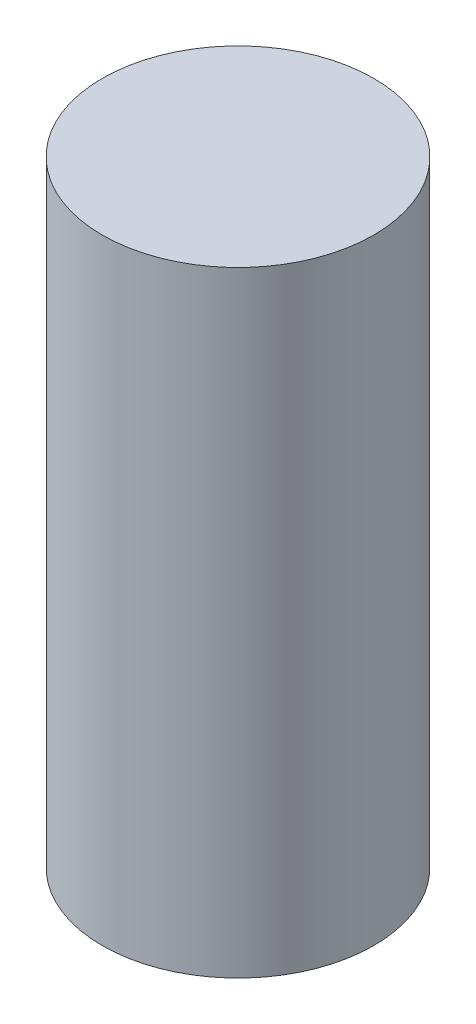
from build123d import *

# Parameters (mm, degrees)
SKETCH3_R           = 1.985
BOSS_EXTRUDE1_DEPTH = 9


with BuildPart() as part:
    # Sketch3 → Boss-Extrude1 (new body)
    with BuildSketch(Plane(origin=(0, 0, 0), x_dir=(1, 0, 0), z_dir=(0, 1, 0))):
        with Locations(Location((0, 0, 0), (0, 0, 270))):
            Circle(SKETCH3_R)
    extrude(amount=BOSS_EXTRUDE1_DEPTH)


solid = part.part
